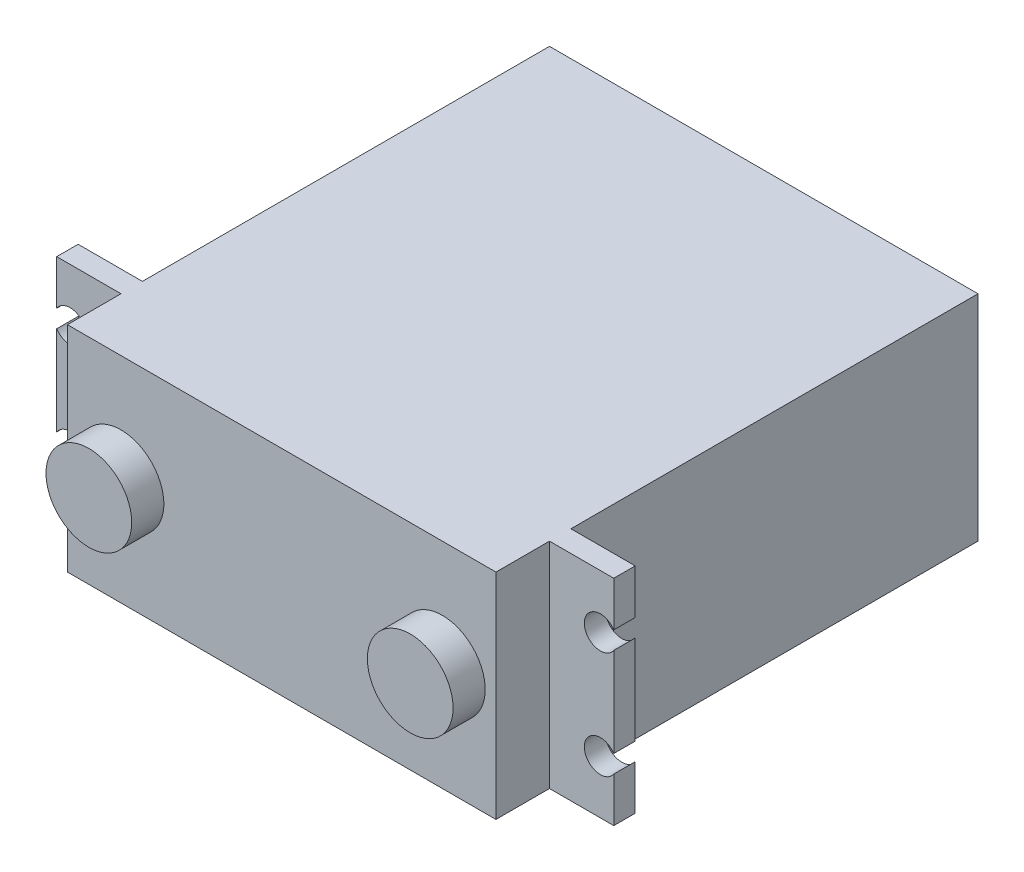
from build123d import *

# Parameters (mm, degrees)
ESQUISSE1_W             = 40
ESQUISSE1_H             = 20
BOSS_EXTRU_1_DEPTH      = 45
ESQUISSE2_R             = 4
BOSS_EXTRU_2_DEPTH      = 3
ESQUISSE3_W             = 2
ESQUISSE3_H             = 20
BOSS_EXTRU_3_DEPTH      = 6
ESQUISSE4_W             = 2
ESQUISSE4_H             = 20
BOSS_EXTRU_4_DEPTH      = 6
ESQUISSE5_R             = 1.5
ENL_V_MAT_EXTRU_1_DEPTH = 6


with BuildPart() as part:
    # Esquisse1 → Boss.-Extru.1 (new body)
    with BuildSketch(Plane.XY):
        with Locations((20, 10)):
            Rectangle(ESQUISSE1_W, ESQUISSE1_H)
    extrude(amount=BOSS_EXTRU_1_DEPTH)

    # Esquisse2 → Boss.-Extru.2 (add)
    with BuildSketch(Plane.XY.offset(45)):
        with Locations(Location((5, 10, 0), (0, 0, 180))):
            Circle(ESQUISSE2_R)
        with Locations(Location((35, 10, 0), (0, 0, 180))):
            Circle(ESQUISSE2_R)
    extrude(amount=BOSS_EXTRU_2_DEPTH)

    # Esquisse3 → Boss.-Extru.3 (add)
    with BuildSketch(Plane.ZY):
        with Locations((39, 10)):
            Rectangle(ESQUISSE3_W, ESQUISSE3_H)
    extrude(amount=BOSS_EXTRU_3_DEPTH)

    # Esquisse4 → Boss.-Extru.4 (add)
    with BuildSketch(Plane(origin=(40, 0, 0), x_dir=(0, 0, -1), z_dir=(1, 0, 0))):
        with Locations((-39, 10)):
            Rectangle(ESQUISSE4_W, ESQUISSE4_H)
    extrude(amount=BOSS_EXTRU_4_DEPTH)

    # Esquisse5 → Enlèv. mat.-Extru.1 (cut)
    with BuildSketch(Plane.XY.offset(40)):
        with Locations((-4.75, 15)):
            Circle(ESQUISSE5_R)
        with Locations((-4.75, 5)):
            Circle(ESQUISSE5_R)
        with Locations((44.75, 15)):
            Circle(ESQUISSE5_R)
        with Locations((44.75, 5)):
            Circle(ESQUISSE5_R)
    extrude(amount=-ENL_V_MAT_EXTRU_1_DEPTH, mode=Mode.SUBTRACT)


solid = part.part
